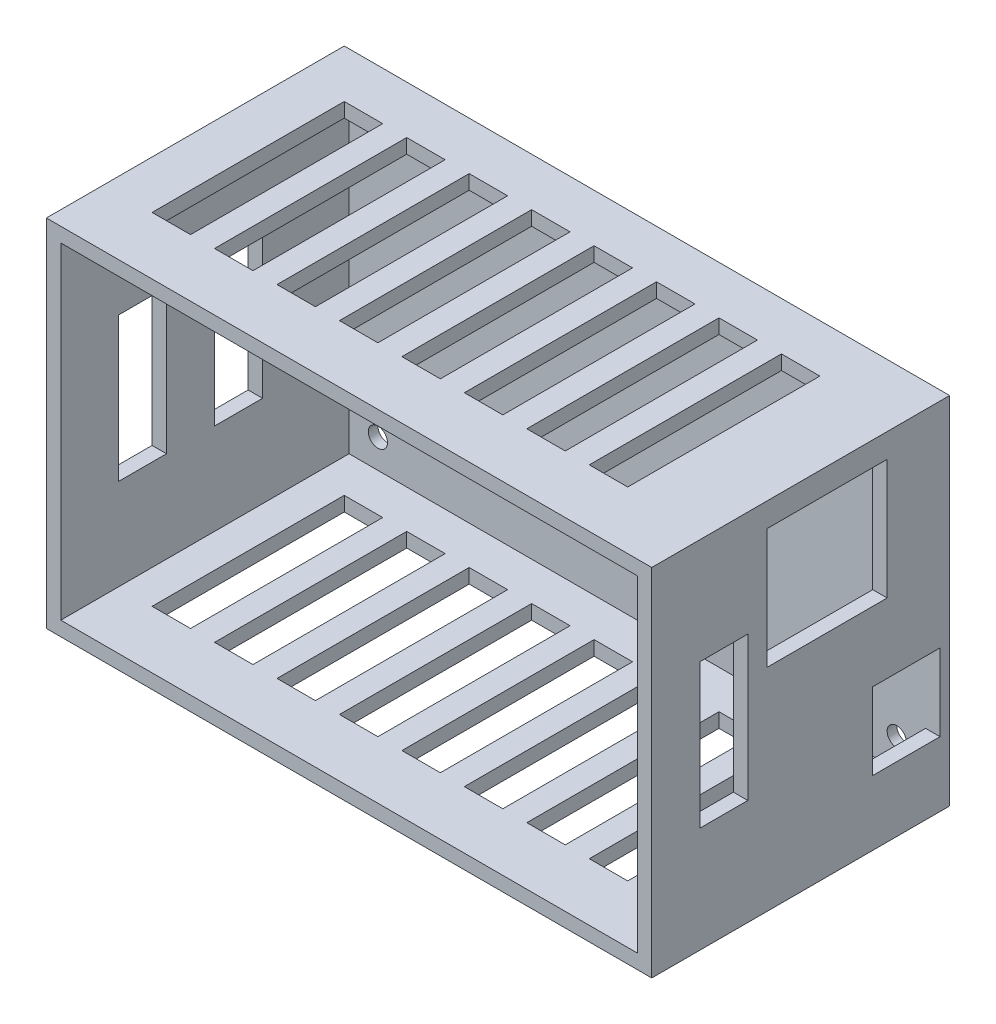
from build123d import *

# Parameters (mm, degrees)
ESBO_O1_W                = 126
ESBO_O1_H                = 74
ESBO_O1_W_2              = 120
ESBO_O1_H_2              = 68
RESSALTO_EXTRUS_O1_DEPTH = 60
ESBO_O2_W                = 126
ESBO_O2_H                = 74
ESBO_O2_R                = 2
RESSALTO_EXTRUS_O2_DEPTH = 2
ESBO_O3_W                = 25
ESBO_O3_H                = 25
ESBO_O3_W_2              = 14
ESBO_O3_H_2              = 16
ESBO_O3_W_3              = 10
ESBO_O3_H_3              = 30
CORTE_EXTRUS_O1_DEPTH    = 10
ESBO_O6_W                = 8
ESBO_O6_H                = 40
CORTE_EXTRUS_O2_DEPTH    = 115.214710086
ESBO_O7_W                = 10
ESBO_O7_H                = 30
CORTE_EXTRUS_O3_DEPTH    = 12


with BuildPart() as part:
    # Esboço1 → Ressalto-extrusão1 (new body)
    with BuildSketch(Plane.XY):
        Rectangle(ESBO_O1_W, ESBO_O1_H)
        Rectangle(ESBO_O1_W_2, ESBO_O1_H_2, mode=Mode.SUBTRACT)
    extrude(amount=RESSALTO_EXTRUS_O1_DEPTH)

    # Esboço2 → Ressalto-extrusão2 (add)
    with BuildSketch(Plane(origin=(0, 0, 0), x_dir=(-1, 0, 0), z_dir=(0, 0, -1))):
        Rectangle(ESBO_O2_W, ESBO_O2_H)
        with Locations((-54, -28)):
            Circle(ESBO_O2_R, mode=Mode.SUBTRACT)
        with Locations((54, -28)):
            Circle(ESBO_O2_R, mode=Mode.SUBTRACT)
        with Locations((54, 28)):
            Circle(ESBO_O2_R, mode=Mode.SUBTRACT)
        with Locations((-54, 28)):
            Circle(ESBO_O2_R, mode=Mode.SUBTRACT)
    extrude(amount=RESSALTO_EXTRUS_O2_DEPTH)

    # Esboço3 → Corte-extrusão1 (cut)
    with BuildSketch(Plane(origin=(63, 0, 0), x_dir=(0, 0, -1), z_dir=(1, 0, 0))):
        with Locations((-23.5, 19.5)):
            Rectangle(ESBO_O3_W, ESBO_O3_H)
        with Locations((-7, -15.5)):
            Rectangle(ESBO_O3_W_2, ESBO_O3_H_2)
        with Locations((-45, 0)):
            Rectangle(ESBO_O3_W_3, ESBO_O3_H_3)
    extrude(amount=-CORTE_EXTRUS_O1_DEPTH, mode=Mode.SUBTRACT)

    # Esboço6 → Corte-extrusão2 (cut, through all)
    with BuildSketch(Plane.XZ.offset(37)):
        with Locations((-49, 28)):
            Rectangle(ESBO_O6_W, ESBO_O6_H)
        with Locations((-36, 28)):
            Rectangle(ESBO_O6_W, ESBO_O6_H)
        with Locations((-23, 28)):
            Rectangle(ESBO_O6_W, ESBO_O6_H)
        with Locations((-10, 28)):
            Rectangle(ESBO_O6_W, ESBO_O6_H)
        with Locations((3, 28)):
            Rectangle(ESBO_O6_W, ESBO_O6_H)
        with Locations((16, 28)):
            Rectangle(ESBO_O6_W, ESBO_O6_H)
        with Locations((29, 28)):
            Rectangle(ESBO_O6_W, ESBO_O6_H)
        with Locations((42, 28)):
            Rectangle(ESBO_O6_W, ESBO_O6_H)
    extrude(amount=-CORTE_EXTRUS_O2_DEPTH, mode=Mode.SUBTRACT)

    # Esboço7 → Corte-extrusão3 (cut)
    with BuildSketch(Plane.ZY.offset(63)):
        with Locations((43, 0)):
            Rectangle(ESBO_O7_W, ESBO_O7_H)
        with Locations((23, 0)):
            Rectangle(ESBO_O7_W, ESBO_O7_H)
    extrude(amount=-CORTE_EXTRUS_O3_DEPTH, mode=Mode.SUBTRACT)


solid = part.part
